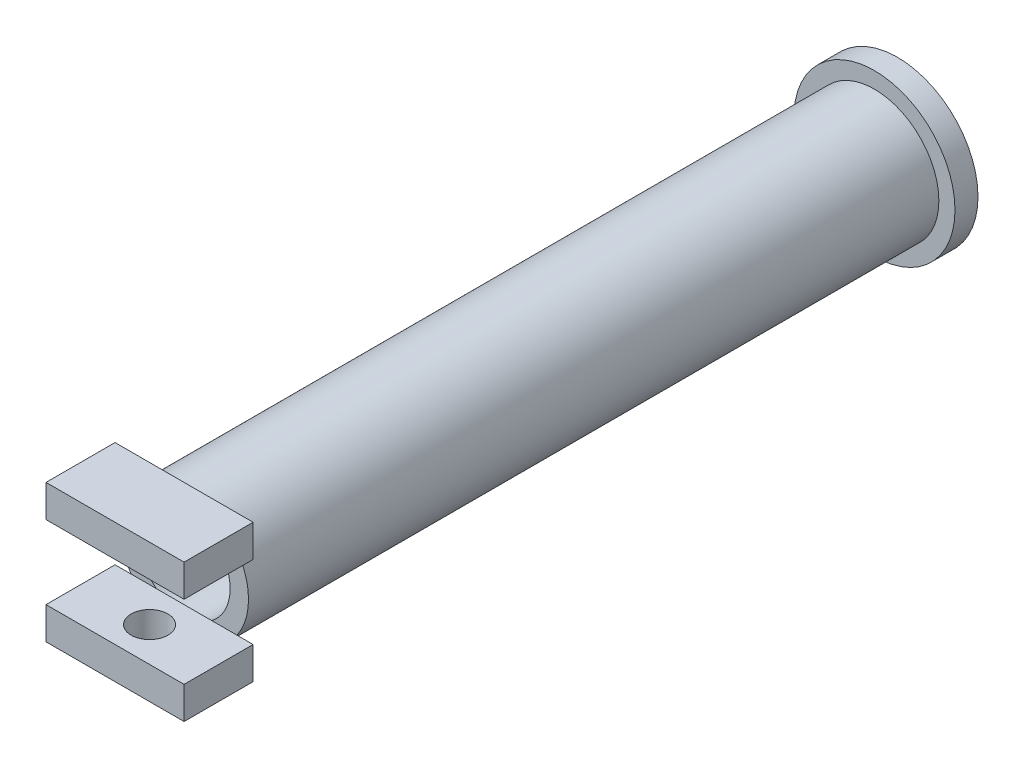
from build123d import *

# Parameters (mm, degrees)
SKETCH1_R           = 17.5
BOSS_EXTRUDE1_DEPTH = 5
SKETCH2_R           = 14
BOSS_EXTRUDE2_DEPTH = 155
SKETCH3_R           = 10
CUT_EXTRUDE2_DEPTH  = 150
SKETCH4_W           = 30
SKETCH4_H           = 30
BOSS_EXTRUDE3_DEPTH = 15
SKETCH5_W           = 30
SKETCH5_H           = 16
CUT_EXTRUDE3_DEPTH  = 15
SKETCH6_R           = 4
CUT_EXTRUDE4_DEPTH  = 30


with BuildPart() as part:
    # Sketch1 → Boss-Extrude1 (new body)
    with BuildSketch(Plane.XY):
        Circle(SKETCH1_R)
    extrude(amount=BOSS_EXTRUDE1_DEPTH)

    # Sketch2 → Boss-Extrude2 (add)
    with BuildSketch(Plane.XY):
        Circle(SKETCH2_R)
    extrude(amount=BOSS_EXTRUDE2_DEPTH)

    # Sketch3 → Cut-Extrude2 (cut)
    with BuildSketch(Plane.XY.offset(155)):
        Circle(SKETCH3_R)
    extrude(amount=-CUT_EXTRUDE2_DEPTH, mode=Mode.SUBTRACT)

    # Sketch4 → Boss-Extrude3 (add)
    with BuildSketch(Plane.XY.offset(155)):
        Rectangle(SKETCH4_W, SKETCH4_H)
    extrude(amount=BOSS_EXTRUDE3_DEPTH)

    # Sketch5 → Cut-Extrude3 (cut)
    with BuildSketch(Plane.XY.offset(170)):
        Rectangle(SKETCH5_W, SKETCH5_H)
    extrude(amount=-CUT_EXTRUDE3_DEPTH, mode=Mode.SUBTRACT)

    # Sketch6 → Cut-Extrude4 (cut)
    with BuildSketch(Plane(origin=(0, 11.5, 0), x_dir=(1, 0, 0), z_dir=(0, 1, 0))):
        with Locations((0, -162.5)):
            Circle(SKETCH6_R)
    extrude(amount=-CUT_EXTRUDE4_DEPTH, mode=Mode.SUBTRACT)


solid = part.part
